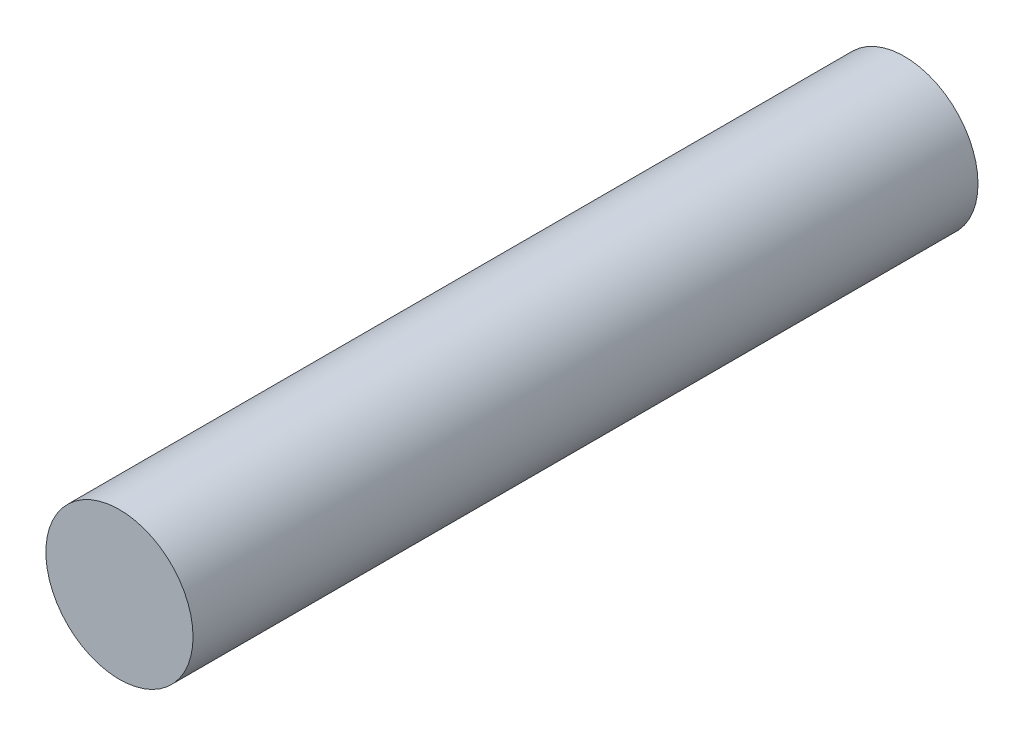
from build123d import *

# Parameters (mm, degrees)
SKETCH1_R           = 38.1
BOSS_EXTRUDE1_DEPTH = 203.2


with BuildPart() as part:
    # Sketch1 → Boss-Extrude1 (new, symmetric)
    with BuildSketch(Plane.XY):
        Circle(SKETCH1_R)
    extrude(amount=BOSS_EXTRUDE1_DEPTH, both=True)


solid = part.part
